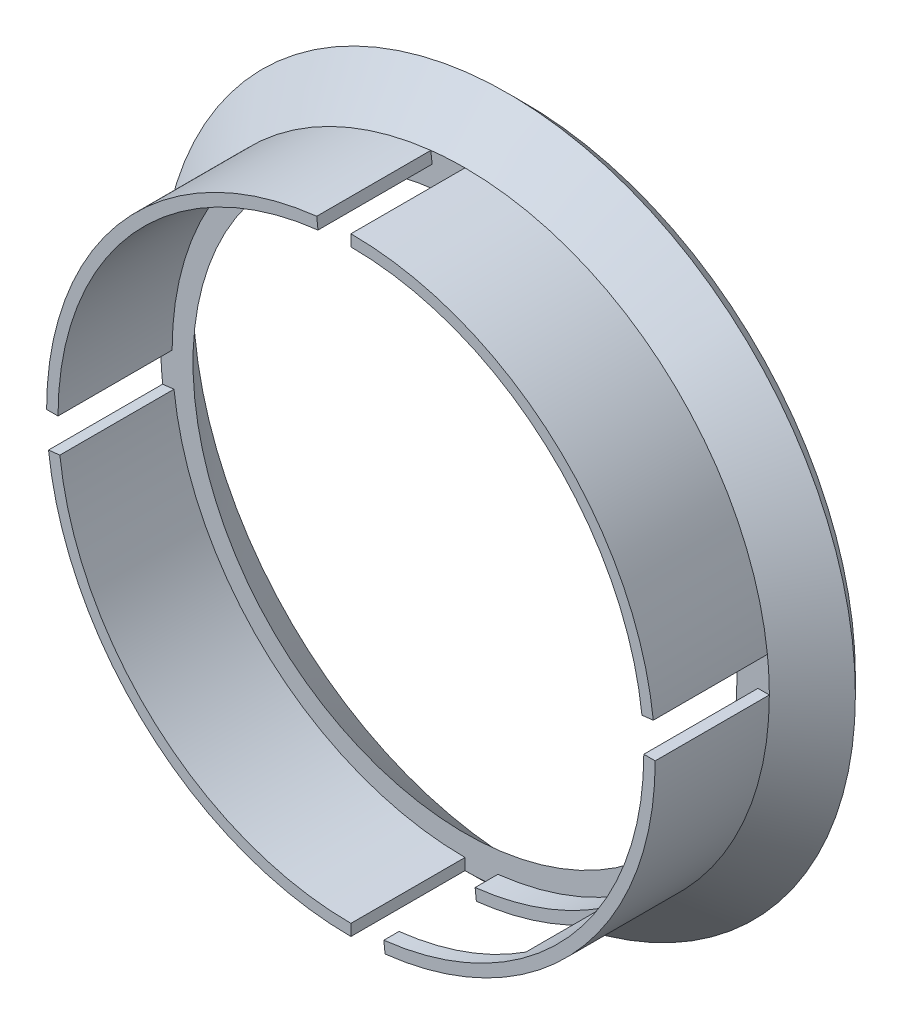
from build123d import *

# Parameters (mm, degrees)
SALIENTE_EXTRUIR1_DEPTH   = 15
SALIENTE_EXTRUIR1_2_DEPTH = 15
SALIENTE_EXTRUIR1_3_DEPTH = 15
SALIENTE_EXTRUIR1_4_DEPTH = 15
CORTAR_EXTRUIR1_REACH     = 68.288
CROQUIS3_W                = 25
CROQUIS3_H                = 10


with BuildPart() as part:
    # Croquis1 → Saliente-Extruir1 (new body)
    with BuildSketch(Plane.XY):
        with BuildLine():
            Line((-4.324392398, 38.256367187), (-4.492875219, 39.746875))
            ThreePointArc((-4.492875219, 39.746875), (-29.830479453, 26.648498937), (-40, 0))
            Line((-40, 0), (-38.5, 0))
            ThreePointArc((-38.5, 0), (-28.711836473, 25.649180227), (-4.324392398, 38.256367187))
        make_face()
    extrude(amount=SALIENTE_EXTRUIR1_DEPTH)



with BuildPart() as body_2:
    # Croquis1 → Saliente-Extruir1 2 (new body)
    with BuildSketch(Plane.XY):
        with BuildLine():
            Line((-38.256367187, -4.324392398), (-39.746875, -4.492875219))
            ThreePointArc((-39.746875, -4.492875219), (-26.648498937, -29.830479453), (0, -40))
            Line((0, -40), (0, -38.5))
            ThreePointArc((0, -38.5), (-25.649180227, -28.711836473), (-38.256367187, -4.324392398))
        make_face()
    extrude(amount=SALIENTE_EXTRUIR1_2_DEPTH)


with BuildPart() as body_3:
    # Croquis1 → Saliente-Extruir1 3 (new body)
    with BuildSketch(Plane.XY):
        with BuildLine():
            ThreePointArc((39.746875, 4.492875219), (26.648498937, 29.830479453), (0, 40))
            Line((0, 40), (0, 38.5))
            ThreePointArc((0, 38.5), (25.649180227, 28.711836473), (38.256367187, 4.324392398))
            Line((38.256367188, 4.324392398), (39.746875, 4.492875219))
        make_face()
    extrude(amount=SALIENTE_EXTRUIR1_3_DEPTH)


with BuildPart() as body_4:
    # Croquis1 → Saliente-Extruir1 4 (new body)
    with BuildSketch(Plane.XY):
        with BuildLine():
            ThreePointArc((4.492875219, -39.746875), (29.830479453, -26.648498937), (40, 0))
            Line((40, 0), (38.5, 0))
            ThreePointArc((38.5, 0), (28.711836473, -25.649180227), (4.324392398, -38.256367188))
            Line((4.324392398, -38.256367188), (4.492875219, -39.746875))
        make_face()
    extrude(amount=SALIENTE_EXTRUIR1_4_DEPTH)


with BuildPart() as part_1:
    add(part.part)

    add(body_2.part)  # Revolución1 merges body 2

    add(body_3.part)  # Revolución1 merges body 3

    add(body_4.part)  # Revolución1 merges body 4
    # Croquis2 → Revolución1 (revolve)
    with BuildSketch(Plane(origin=(0, 0, 0), x_dir=(1, 0, 0), z_dir=(0, 1, 0)), mode=Mode.PRIVATE) as revoluci_n1_sk:
        Polygon((-40, 0), (-45.656854249, 5.656854249), (-43.535533906, 7.778174593), (-35.757359313, 0), align=None)
    revolve(revoluci_n1_sk.sketch.rotate(Axis((0, 0, 0), (0, 0, -1)), 180), axis=Axis((0, 0, 0), (0, 0, -1)))

    # Croquis3 → Cortar-Extruir1 (cut, up to next)
    with BuildSketch(Plane(origin=(0, 0, 0), x_dir=(1, 0, 0), z_dir=(0, 1, 0)), mode=Mode.PRIVATE) as cortar_extruir1_sk1:
        with Locations((8.5, -8)):
            Rectangle(CROQUIS3_W, CROQUIS3_H)
    cortar_extruir1_tool1 = extrude(cortar_extruir1_sk1.sketch, amount=-CORTAR_EXTRUIR1_REACH, mode=Mode.PRIVATE) & part_1.part
    add(cortar_extruir1_tool1.solids().sort_by_distance((8.5, 0, 8))[0], mode=Mode.SUBTRACT)


solid = part_1.part
